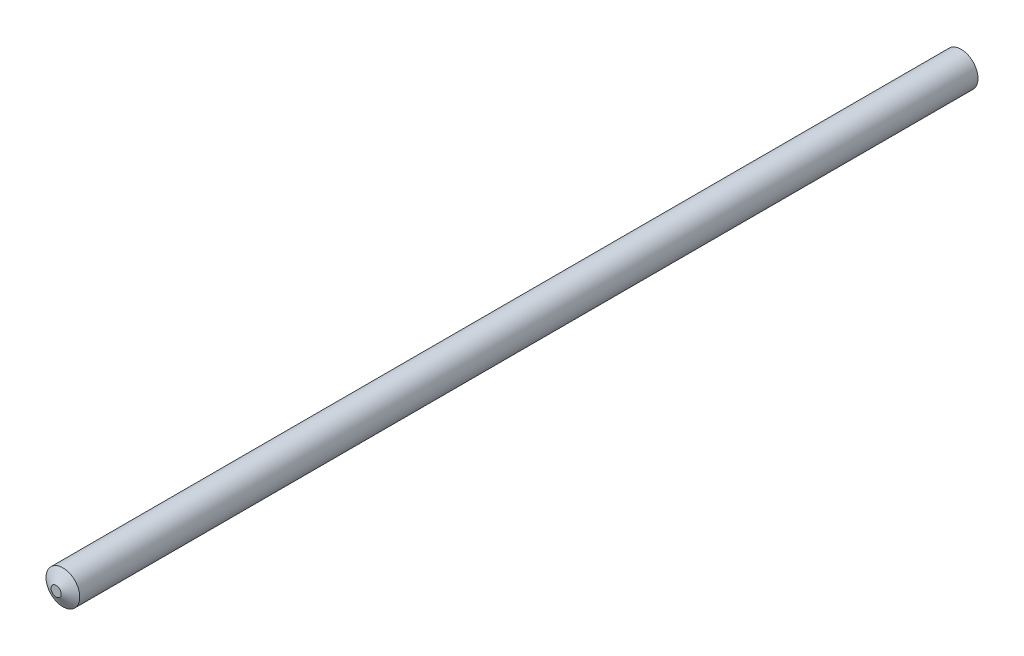
from build123d import *

# Parameters (mm, degrees)
CROQUIS1_R              = 5
SALIENTE_EXTRUIR1_DEPTH = 270


with BuildPart() as part:
    # Croquis1 → Saliente-Extruir1 (new body)
    with BuildSketch(Plane.XY):
        Circle(CROQUIS1_R)
    extrude(amount=SALIENTE_EXTRUIR1_DEPTH)

    # Cortar-Barrer1: sweep along a curve in space
    with BuildLine() as cortar_barrer1_path:
        ThreePointArc((5, 0, 270), (3.535533906, 3.535533906, 270), (0, 5, 270))
        ThreePointArc((0, 5, 270), (-3.535533906, 3.535533906, 270), (-5, 0, 270))
        ThreePointArc((-5, 0, 270), (-3.535533906, -3.535533906, 270), (0, -5, 270))
        ThreePointArc((0, -5, 270), (3.535533906, -3.535533906, 270), (5, 0, 270))
    # Croquis3 → Cortar-Barrer1 (sweep, cut)
    with BuildSketch(Plane(origin=(0, 0, 0), x_dir=(1, 0, 0), z_dir=(0, 1, 0))):
        Polygon((1.5, -270), (5, -267.999621553), (5, -270), align=None)
    sweep(path=cortar_barrer1_path.line, mode=Mode.SUBTRACT)

    # Cortar-Barrer2: sweep along a curve in space
    with BuildLine() as cortar_barrer2_path:
        ThreePointArc((5, 0, 0), (3.535533906, 3.535533906, 0), (0, 5, 0))
        ThreePointArc((0, 5, 0), (-3.535533906, 3.535533906, 0), (-5, 0, 0))
        ThreePointArc((-5, 0, 0), (-3.535533906, -3.535533906, 0), (0, -5, 0))
        ThreePointArc((0, -5, 0), (3.535533906, -3.535533906, 0), (5, 0, 0))
    # Croquis4 → Cortar-Barrer2 (sweep, cut)
    with BuildSketch(Plane(origin=(0, 0, 0), x_dir=(1, 0, 0), z_dir=(0, 1, 0))):
        Polygon((5, 0), (5, -2), (1.5, 0), align=None)
    sweep(path=cortar_barrer2_path.line, mode=Mode.SUBTRACT)


solid = part.part
